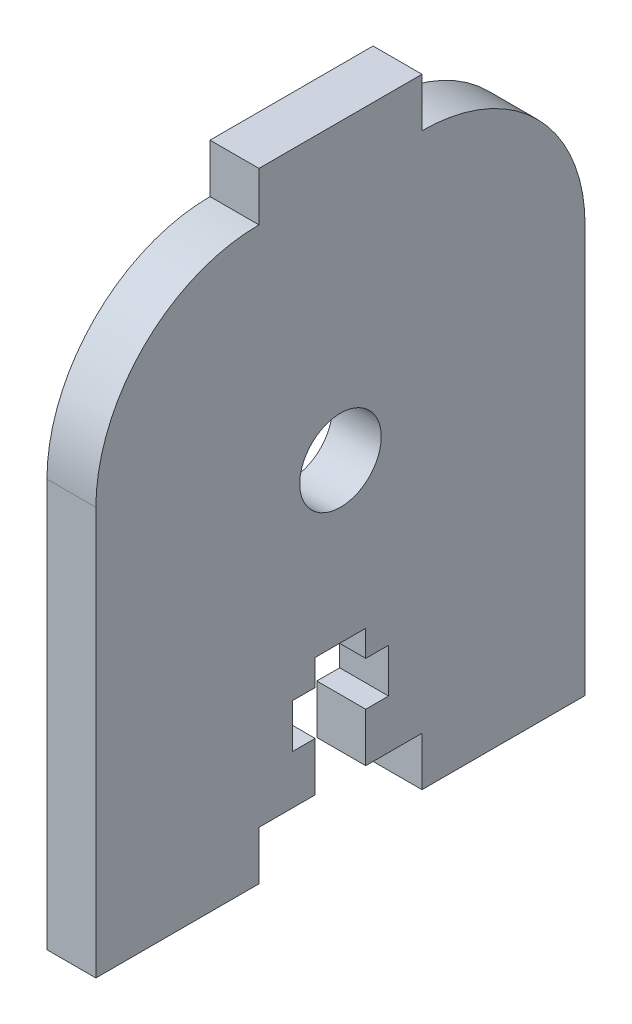
from build123d import *

# Parameters (mm, degrees)
SKETCH1_W                 = 30
SKETCH1_H                 = 35
BOSS_EXTRUDE1_DEPTH       = 3
FILLET1_R                 = 10
SKETCH2_W                 = 10
SKETCH2_H                 = 3
CUT_EXTRUDE1_DEPTH        = 3
F_5_0MM_DOWEL_HOLE1_D     = 5
F_5_0MM_DOWEL_HOLE1_DEPTH = 3
F_5_0MM_DOWEL_HOLE1_TIP   = 1.502151548
CUT_EXTRUDE2_DEPTH        = 3
SKETCH6_W                 = 3
SKETCH6_H                 = 10
BOSS_EXTRUDE2_DEPTH       = 3


with BuildPart() as part:
    # Sketch1 → Boss-Extrude1 (new body)
    with BuildSketch(Plane(origin=(0, 0, 0), x_dir=(0, 0, -1), z_dir=(1, 0, 0))):
        with Locations((15, 17.5)):
            Rectangle(SKETCH1_W, SKETCH1_H)
    extrude(amount=BOSS_EXTRUDE1_DEPTH)

    # Fillet1
    fillet1_edges = [part.edges().sort_by_distance(p)[0] for p in [
        (1.5, 35, 0),
        (1.5, 35, -30),
    ]]
    fillet(fillet1_edges, radius=FILLET1_R)

    # Sketch2 → Cut-Extrude1 (cut)
    with BuildSketch(Plane(origin=(3, 0, 0), x_dir=(0, 0, -1), z_dir=(1, 0, 0))):
        with Locations((15, 1.5)):
            Rectangle(SKETCH2_W, SKETCH2_H)
    extrude(amount=-CUT_EXTRUDE1_DEPTH, mode=Mode.SUBTRACT)

    # Ø5.0mm Dowel Hole1
    with Locations(Plane(origin=(3, 0, 0), x_dir=(0, 0, -1), z_dir=(1, 0, 0))):
        with Locations((15, 20)):
            Hole(F_5_0MM_DOWEL_HOLE1_D / 2, depth=F_5_0MM_DOWEL_HOLE1_DEPTH)
            with Locations((0, 0, -(F_5_0MM_DOWEL_HOLE1_DEPTH + F_5_0MM_DOWEL_HOLE1_TIP / 2))):  # 118° drill point
                Cone(0, F_5_0MM_DOWEL_HOLE1_D / 2, F_5_0MM_DOWEL_HOLE1_TIP, mode=Mode.SUBTRACT)

    # Sketch5 → Cut-Extrude2 (cut)
    with BuildSketch(Plane(origin=(3, 0, 0), x_dir=(0, 0, -1), z_dir=(1, 0, 0))):
        Polygon((13.45, 3), (13.45, 6), (12.05, 6), (12.05, 8.7), (13.45, 8.7), (13.45, 10.3), (16.55, 10.3), (16.55, 8.7), (17.95, 8.7), (17.95, 6), (16.55, 6), (16.55, 3), align=None)
    extrude(amount=-CUT_EXTRUDE2_DEPTH, mode=Mode.SUBTRACT)

    # Sketch6 → Boss-Extrude2 (add)
    with BuildSketch(Plane(origin=(0, 35, 0), x_dir=(1, 0, 0), z_dir=(0, 1, 0))):
        with Locations((1.5, 15)):
            Rectangle(SKETCH6_W, SKETCH6_H)
    extrude(amount=BOSS_EXTRUDE2_DEPTH)


solid = part.part
